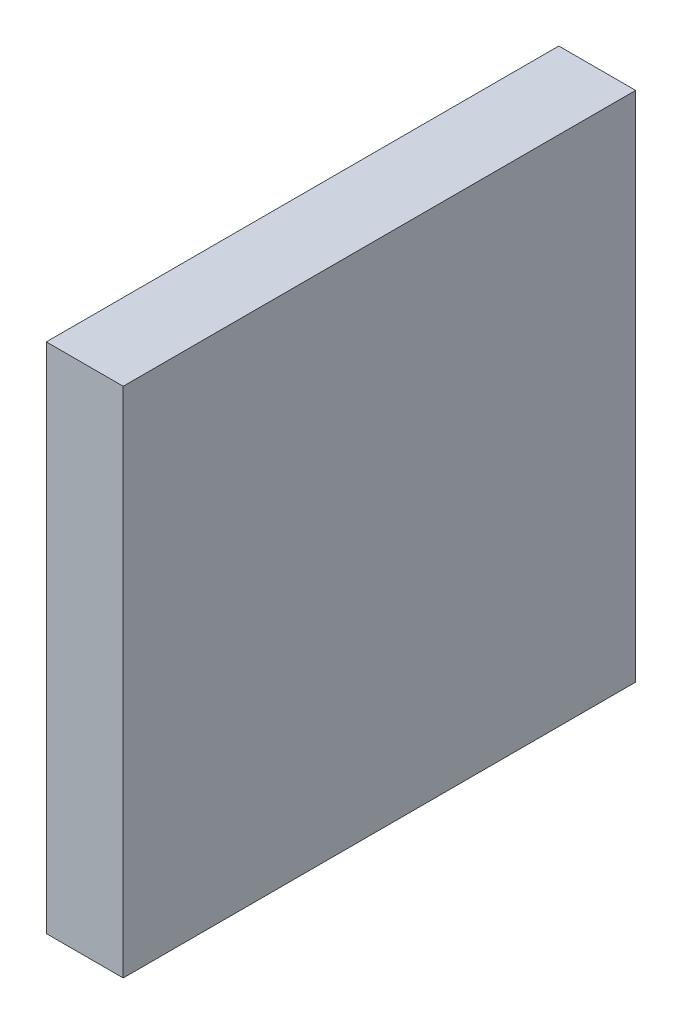
from build123d import *

# Parameters (mm, degrees)
CROQUIS1_W              = 100
CROQUIS1_H              = 100
SALIENTE_EXTRUIR1_DEPTH = 15


with BuildPart() as part:
    # Croquis1 → Saliente-Extruir1 (new body)
    with BuildSketch(Plane(origin=(0, 0, 0), x_dir=(0, 0, -1), z_dir=(1, 0, 0))):
        with Locations((50, 50)):
            Rectangle(CROQUIS1_W, CROQUIS1_H)
    extrude(amount=SALIENTE_EXTRUIR1_DEPTH)


solid = part.part
